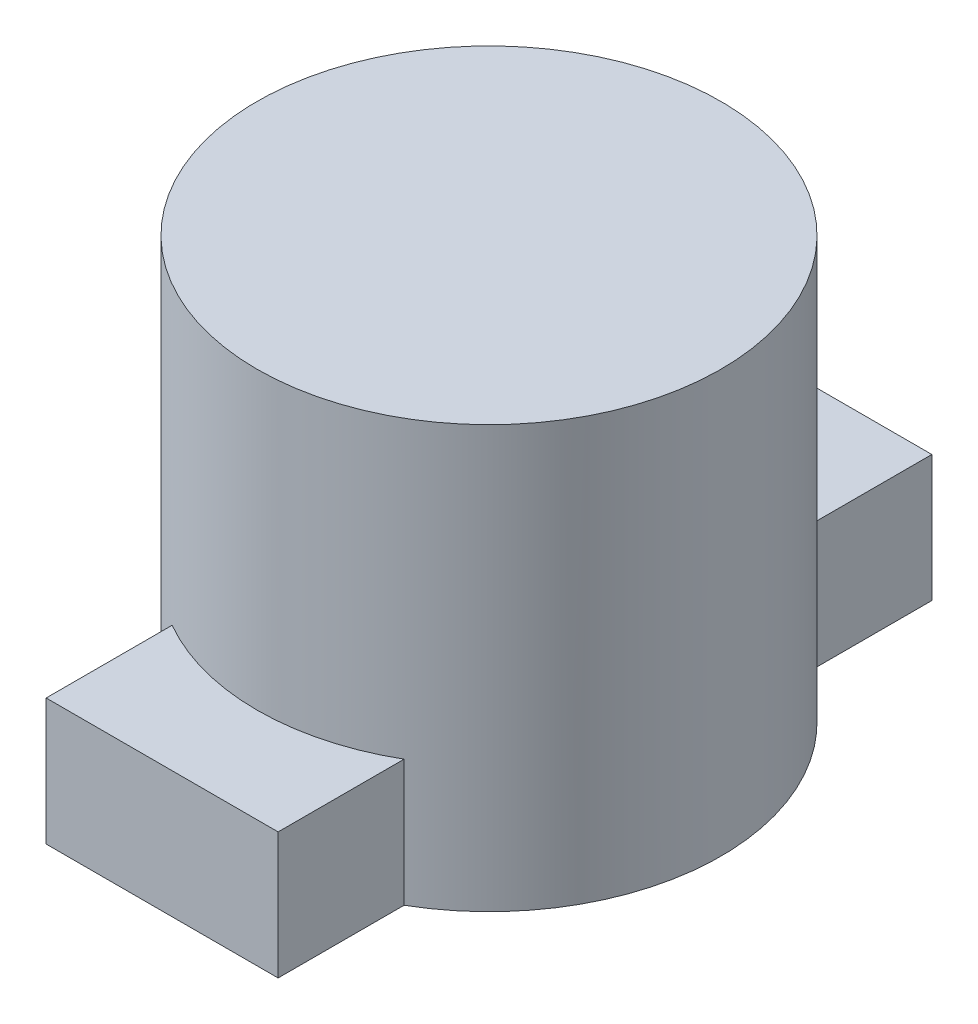
from build123d import *

# Parameters (mm, degrees)
CROQUIS1_R              = 5.5
SALIENTE_EXTRUIR1_DEPTH = 10
CROQUIS3_W              = 5.5
CROQUIS3_H              = 15.5
SALIENTE_EXTRUIR2_DEPTH = 3


with BuildPart() as part:
    # Croquis1 → Saliente-Extruir1 (new body)
    with BuildSketch(Plane(origin=(0, 0, 0), x_dir=(1, 0, 0), z_dir=(0, 1, 0))):
        with Locations(Location((-6.881511077, -6.29378807, 0), (0, 0, 270))):
            Circle(CROQUIS1_R)
    extrude(amount=SALIENTE_EXTRUIR1_DEPTH)

    # Croquis3 → Saliente-Extruir2 (add)
    with BuildSketch(Plane(origin=(0, 0, 0), x_dir=(1, 0, 0), z_dir=(0, 1, 0))):
        with Locations((-6.881511077, -6.29378807)):
            Rectangle(CROQUIS3_W, CROQUIS3_H)
    extrude(amount=SALIENTE_EXTRUIR2_DEPTH)


solid = part.part
